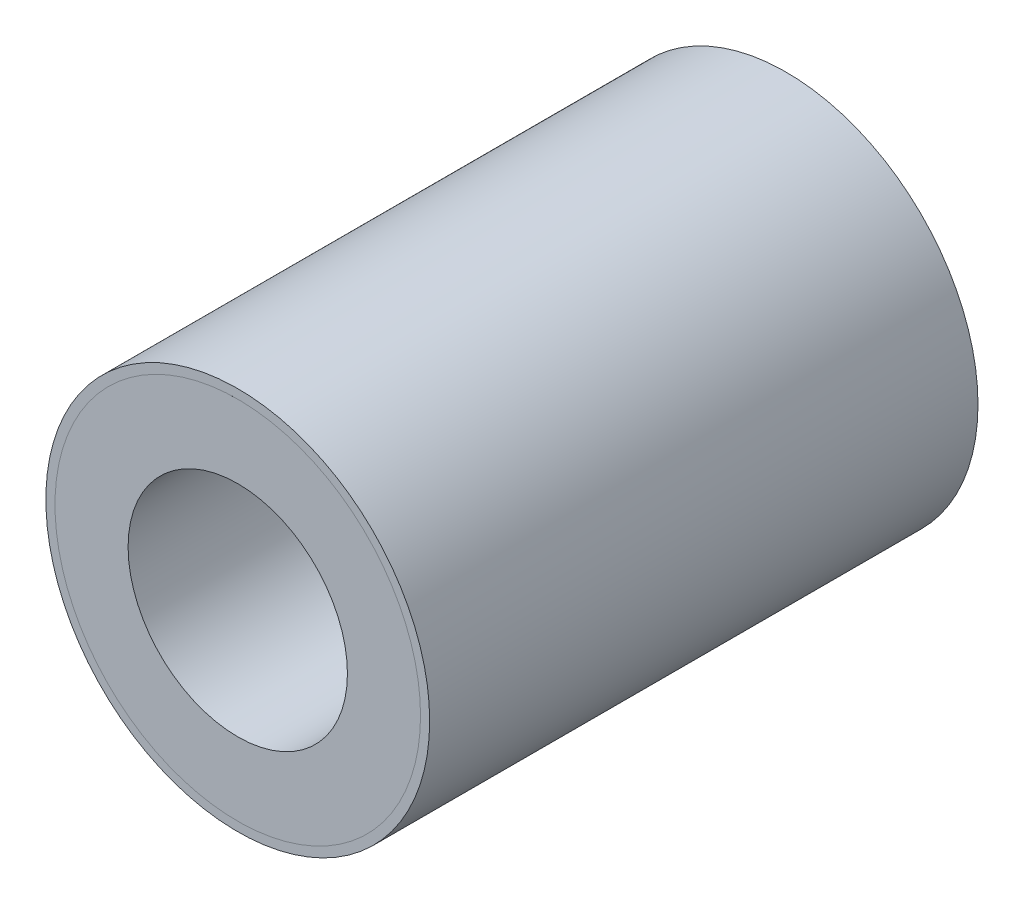
from build123d import *

# Parameters (mm, degrees)
SKETCH1_R           = 10
SKETCH1_R_2         = 6
BOSS_EXTRUDE1_DEPTH = 30
SKETCH1_3_R         = 10.5
SKETCH1_3_R_2       = 10
BOSS_EXTRUDE2_DEPTH = 30


with BuildPart() as part:
    # Sketch1 → Boss-Extrude1 (new body)
    with BuildSketch(Plane.XY):
        Circle(SKETCH1_R)
        Circle(SKETCH1_R_2, mode=Mode.SUBTRACT)
    extrude(amount=BOSS_EXTRUDE1_DEPTH)


with BuildPart() as body_2:
    # Sketch1<3> → Boss-Extrude2 (new body)
    with BuildSketch(Plane.XY):
        Circle(SKETCH1_3_R)
        Circle(SKETCH1_3_R_2, mode=Mode.SUBTRACT)
    extrude(amount=BOSS_EXTRUDE2_DEPTH)


solid = Compound([part.part, body_2.part])
